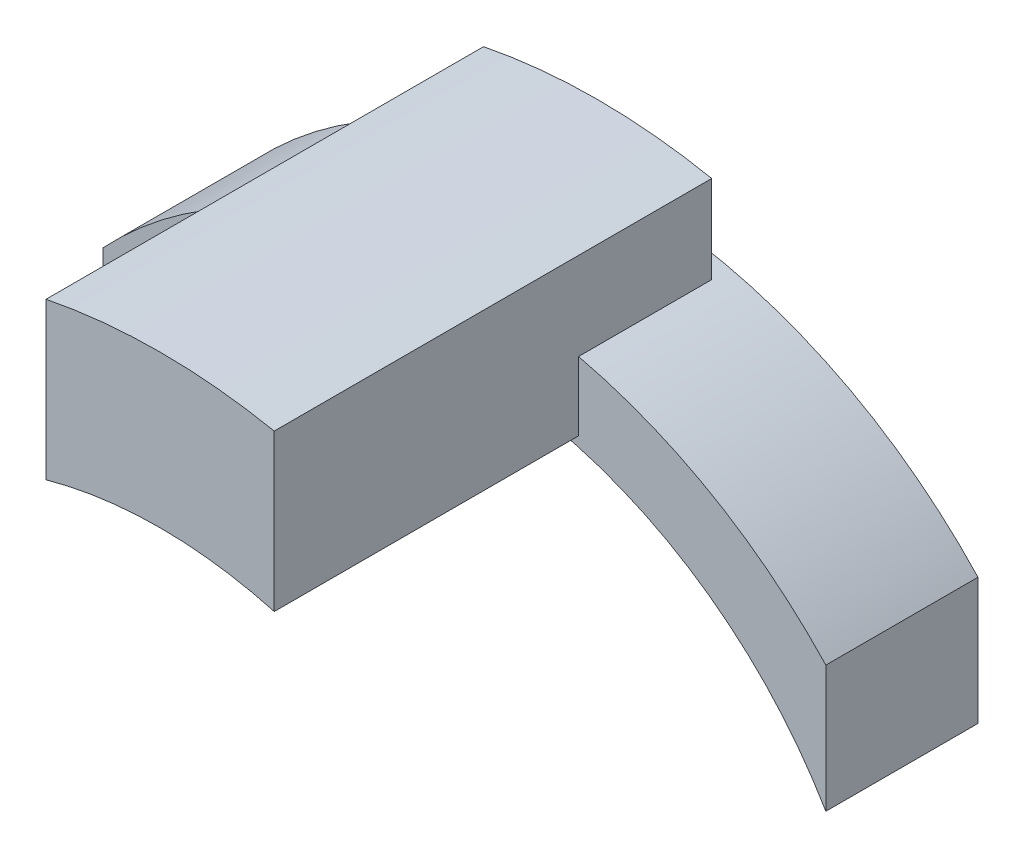
from build123d import *

# Parameters (mm, degrees)
EXTRUDE1_DEPTH      = 4
EXTRUDE2_DEPTH      = 7
EXTRUDE2_DEPTH_BACK = 16


with BuildPart() as part:
    # Sketch1 → Extrude1 (new, symmetric)
    with BuildSketch(Plane.XY):
        with BuildLine():
            Line((-19, 11.090536506), (-19, 17.748239349))
            ThreePointArc((-19, 17.748239349), (0, 26), (19, 17.748239349))
            Line((19, 17.748239349), (19, 11.090536506))
            ThreePointArc((19, 11.090536506), (0, 22), (-19, 11.090536506))
        make_face()
    extrude(amount=EXTRUDE1_DEPTH, both=True)

    # Sketch2 → Extrude2 (add, two sides: drawn at the far end of the back side and taken through both)
    with BuildSketch(Plane(origin=(0, 0, 4), x_dir=(-1, 0, 0), z_dir=(0, 0, -1)).offset(-EXTRUDE2_DEPTH_BACK)):
        with BuildLine():
            Line((6, 21.685248442), (6, 29.904013109))
            ThreePointArc((6, 29.904013109), (0, 30.5), (-6, 29.904013109))
            Line((-6, 29.904013109), (-6, 21.685248442))
            ThreePointArc((-6, 21.685248442), (0, 22.5), (6, 21.685248442))
        make_face()
    extrude(amount=EXTRUDE2_DEPTH + EXTRUDE2_DEPTH_BACK)


solid = part.part
